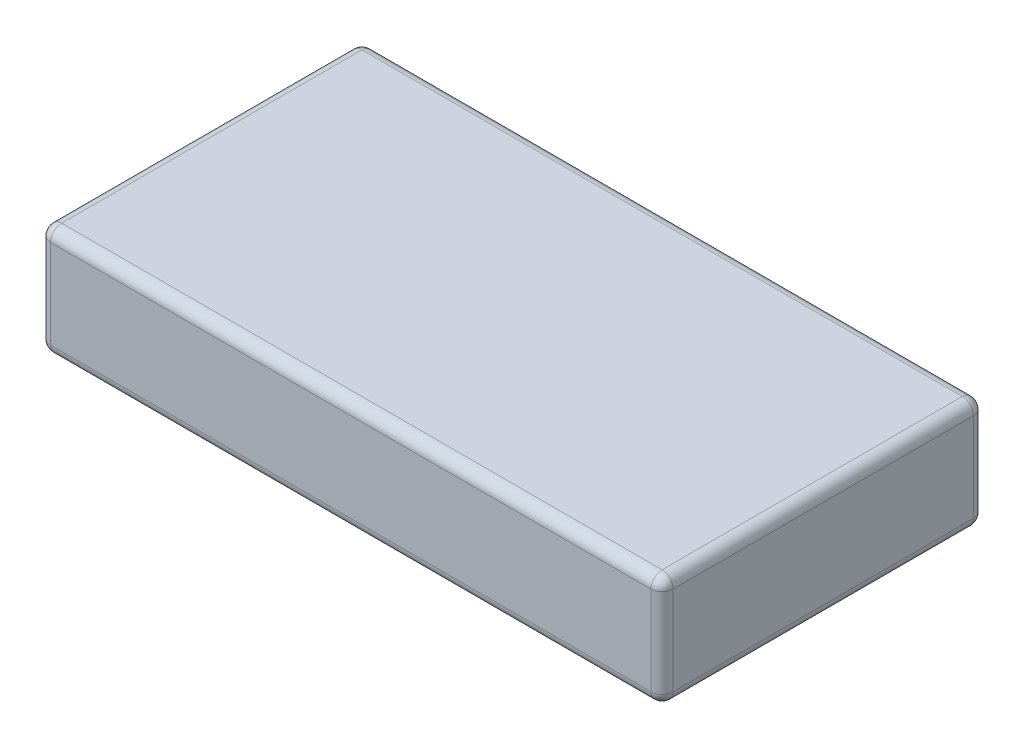
from build123d import *

# Parameters (mm, degrees)
SKETCH_1_W      = 56
SKETCH_1_H      = 29
EXTRUDE_1_DEPTH = 10
FILLET_1_R      = 1


with BuildPart() as part:
    # 草图1 → 凸台-拉伸1 (new body)
    with BuildSketch(Plane(origin=(0, 0, 0), x_dir=(1, 0, 0), z_dir=(0, 1, 0))):
        Rectangle(SKETCH_1_W, SKETCH_1_H)
    extrude(amount=EXTRUDE_1_DEPTH)

    # 圆角1
    fillet_1_edges = [part.edges().sort_by_distance(p)[0] for p in [
        (-28, 10, 0),
        (0, 10, 14.5),
        (28, 10, 0),
        (0, 0, 14.5),
        (-28, 0, 0),
        (0, 0, -14.5),
        (28, 0, 0),
        (0, 10, -14.5),
        (28, 5, 14.5),
        (-28, 5, 14.5),
        (-28, 5, -14.5),
        (28, 5, -14.5),
    ]]
    fillet(fillet_1_edges, radius=FILLET_1_R)


solid = part.part
